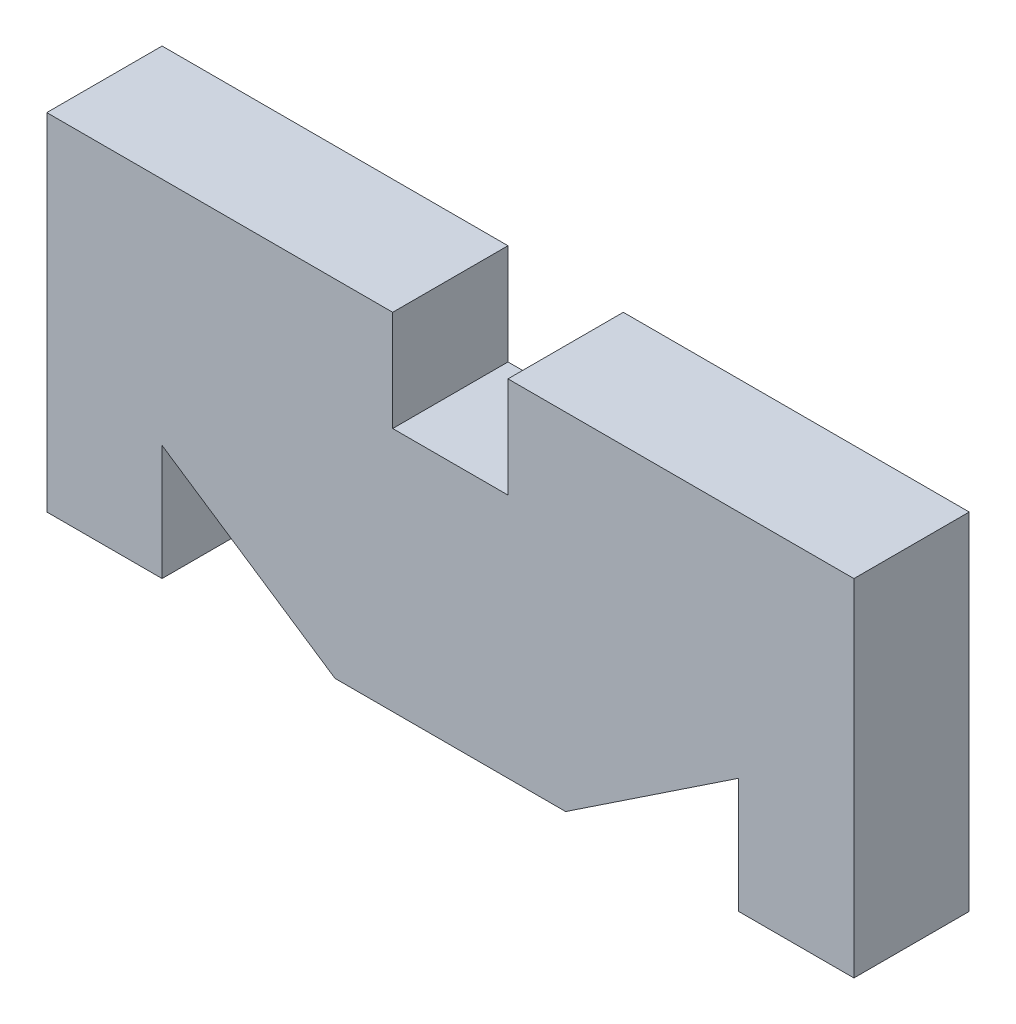
from build123d import *

# Parameters (mm, degrees)
Y_KSEKLIK_EKSTR_ZYON1_DEPTH = 10


with BuildPart() as part:
    # Çizim1 → Yükseklik-Ekstrüzyon1 (new body)
    with BuildSketch(Plane.XY):
        Polygon((-25.037475014, -11), (-25.037475014, -1), (-10.037475014, -11), (9.962524986, -11), (24.962524986, -1), (24.962524986, -11), (34.962524986, -11), (34.962524986, 19), (4.962524986, 19), (4.962524986, 10.269772932), (-5.037475014, 10.269772932), (-5.037475014, 19), (-35.037475014, 19), (-35.037475014, -11), align=None)
    extrude(amount=Y_KSEKLIK_EKSTR_ZYON1_DEPTH)


solid = part.part
